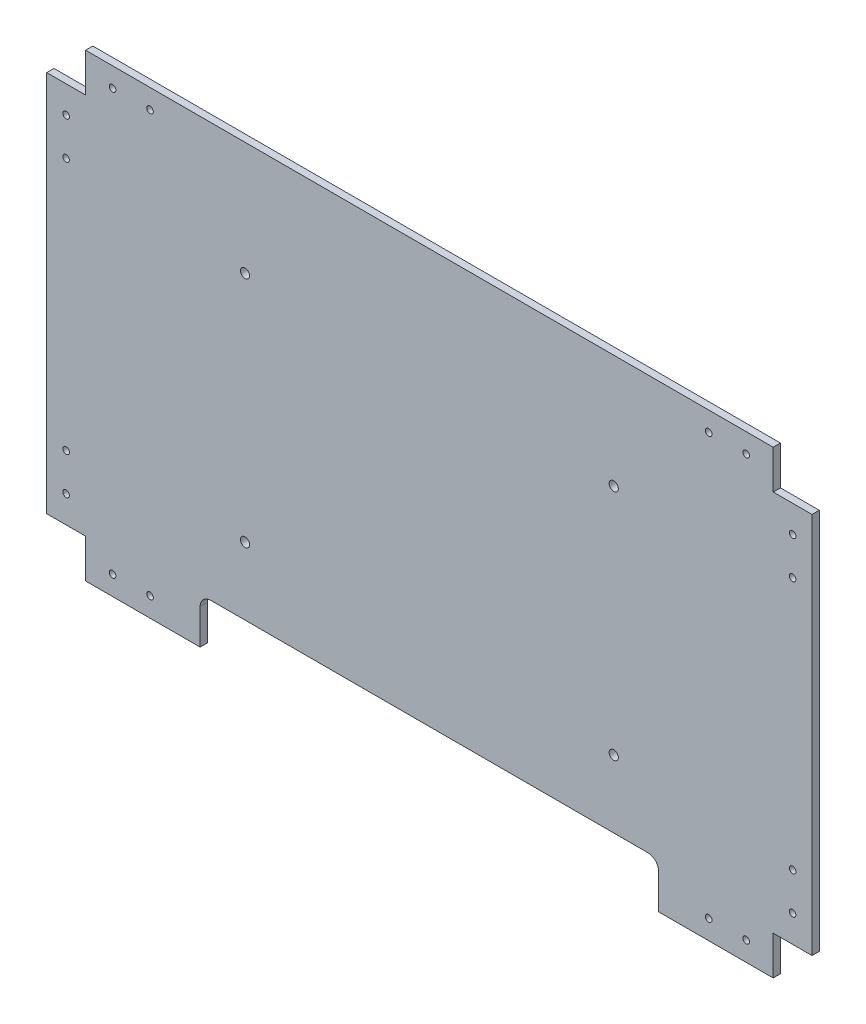
from build123d import *

# Parameters (mm, degrees)
SKETCH_1_W          = 500.8
SKETCH_1_H          = 300.8
EXTRUDE_1_DEPTH     = 4.75
SKETCH_2_R          = 3
SKETCH_2_W          = 25.4
SKETCH_2_H          = 25.4
CUT_EXTRUDE_1_DEPTH = 10
SKETCH_3_R          = 2.15
CUT_EXTRUDE_2_DEPTH = 5
SKETCH_4_R          = 2.15
CUT_EXTRUDE_3_DEPTH = 5
SKETCH_5_R          = 2.15
SKETCH_5_R_2        = 2.150000001
CUT_EXTRUDE_4_DEPTH = 5
SKETCH_7_R          = 2.15
SKETCH_7_R_2        = 2.150000004
CUT_EXTRUDE_6_DEPTH = 5
SKETCH_8_W          = 300
SKETCH_8_H          = 30
CUT_EXTRUDE_7_DEPTH = 10
FILLET_2_R          = 7


with BuildPart() as part:
    # 草圖1 → 填料-伸長1 (new body)
    with BuildSketch(Plane.XY):
        Rectangle(SKETCH_1_W, SKETCH_1_H)
    extrude(amount=EXTRUDE_1_DEPTH)

    # 草圖2 → 除料-伸長1 (cut)
    with BuildSketch(Plane(origin=(0, 0, 0), x_dir=(-1, 0, 0), z_dir=(0, 0, -1))):
        with Locations((-120.65, 76.2)):
            Circle(SKETCH_2_R)
        with Locations((-120.65, -76.2)):
            Circle(SKETCH_2_R)
        with Locations((120.65, -76.2)):
            Circle(SKETCH_2_R)
        with Locations((120.65, 76.2)):
            Circle(SKETCH_2_R)
        with Locations((-237.7, 137.7)):
            Rectangle(SKETCH_2_W, SKETCH_2_H)
        with Locations((-237.7, -137.7)):
            Rectangle(SKETCH_2_W, SKETCH_2_H)
        with Locations((237.7, 137.7)):
            Rectangle(SKETCH_2_W, SKETCH_2_H)
        with Locations((237.7, -137.7)):
            Rectangle(SKETCH_2_W, SKETCH_2_H)
    extrude(amount=-CUT_EXTRUDE_1_DEPTH, mode=Mode.SUBTRACT)

    # 草圖3 → 除料-伸長2 (cut)
    with BuildSketch(Plane.XY.offset(4.75)):
        with Locations((207.3, 137.7)):
            Circle(SKETCH_3_R)
        with Locations((182.8, 137.7)):
            Circle(SKETCH_3_R)
    extrude(amount=-CUT_EXTRUDE_2_DEPTH, mode=Mode.SUBTRACT)

    # 草圖4 → 除料-伸長3 (cut)
    with BuildSketch(Plane.XY.offset(4.75)):
        with Locations((237.7, 82.8)):
            Circle(SKETCH_4_R)
        with Locations((237.7, 107.3)):
            Circle(SKETCH_4_R)
    extrude(amount=-CUT_EXTRUDE_3_DEPTH, mode=Mode.SUBTRACT)

    # 草圖5 → 除料-伸長4 (cut)
    with BuildSketch(Plane.XY.offset(4.75)):
        with Locations((237.7, -107.300000014)):
            Circle(SKETCH_5_R)
        with Locations((237.7, -82.800000014)):
            Circle(SKETCH_5_R)
        with Locations((207.3, -137.7)):
            Circle(SKETCH_5_R_2)
        with Locations((182.8, -137.7)):
            Circle(SKETCH_5_R)
    extrude(amount=-CUT_EXTRUDE_4_DEPTH, mode=Mode.SUBTRACT)

    # 草圖7 → 除料-伸長6 (cut)
    with BuildSketch(Plane.XY.offset(4.75)):
        with Locations((-182.8, -137.7)):
            Circle(SKETCH_7_R)
        with Locations((-207.3, -137.7)):
            Circle(SKETCH_7_R)
        with Locations((-237.7, -107.3)):
            Circle(SKETCH_7_R)
        with Locations((-237.7, -82.8)):
            Circle(SKETCH_7_R)
        with Locations((-237.7, 82.800000014)):
            Circle(SKETCH_7_R_2)
        with Locations((-237.7, 107.300000014)):
            Circle(SKETCH_7_R_2)
        with Locations((-207.3, 137.7)):
            Circle(SKETCH_7_R)
        with Locations((-182.8, 137.7)):
            Circle(SKETCH_7_R)
    extrude(amount=-CUT_EXTRUDE_6_DEPTH, mode=Mode.SUBTRACT)

    # 草圖8 → 除料-伸長7 (cut)
    with BuildSketch(Plane(origin=(0, 0, 0), x_dir=(-1, 0, 0), z_dir=(0, 0, -1))):
        with Locations((0, -135.4)):
            Rectangle(SKETCH_8_W, SKETCH_8_H)
    extrude(amount=-CUT_EXTRUDE_7_DEPTH, mode=Mode.SUBTRACT)

    # 圓角2
    fillet_2_edges = [part.edges().sort_by_distance(p)[0] for p in [
        (150, -120.4, 2.375),
        (-150, -120.4, 2.375),
    ]]
    fillet(fillet_2_edges, radius=FILLET_2_R)


solid = part.part
